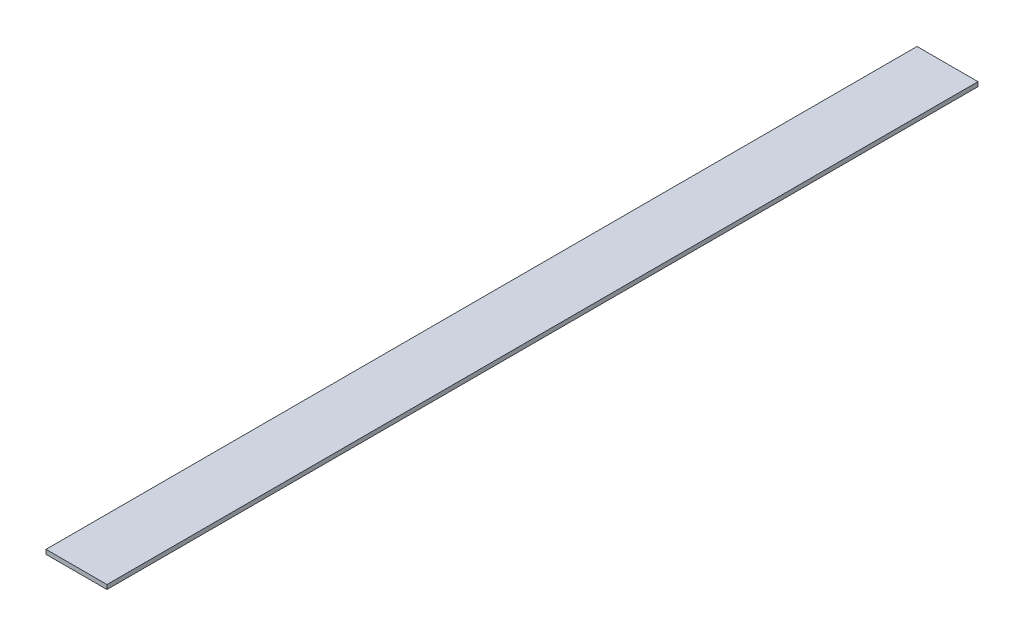
from build123d import *

# Parameters (mm, degrees)
SKETCH1_W           = 14
SKETCH1_H           = 200
BOSS_EXTRUDE1_DEPTH = 1


with BuildPart() as part:
    # Sketch1 → Boss-Extrude1 (new body)
    with BuildSketch(Plane(origin=(0, 0, 0), x_dir=(1, 0, 0), z_dir=(0, 1, 0))):
        with Locations((7, 100)):
            Rectangle(SKETCH1_W, SKETCH1_H)
    extrude(amount=BOSS_EXTRUDE1_DEPTH)


solid = part.part
